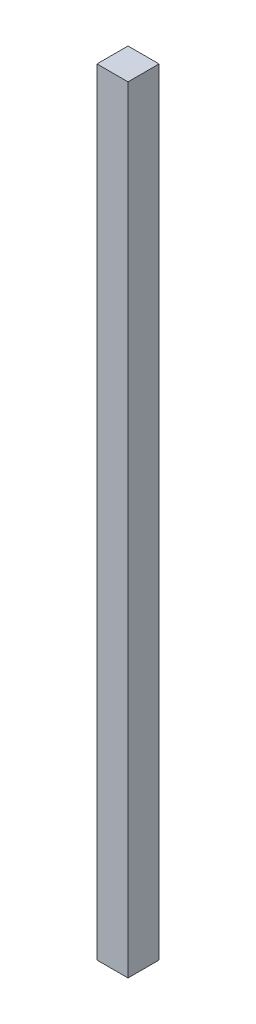
from build123d import *

# Parameters (mm, degrees)
SKIZZE1_W                       = 40
SKIZZE1_H                       = 1000
AUFSATZ_LINEAR_AUSTRAGEN1_DEPTH = 40


with BuildPart() as part:
    # Skizze1 → Aufsatz-Linear austragen1 (new body)
    with BuildSketch(Plane.XY):
        with Locations((20, 500)):
            Rectangle(SKIZZE1_W, SKIZZE1_H)
    extrude(amount=AUFSATZ_LINEAR_AUSTRAGEN1_DEPTH)


solid = part.part
